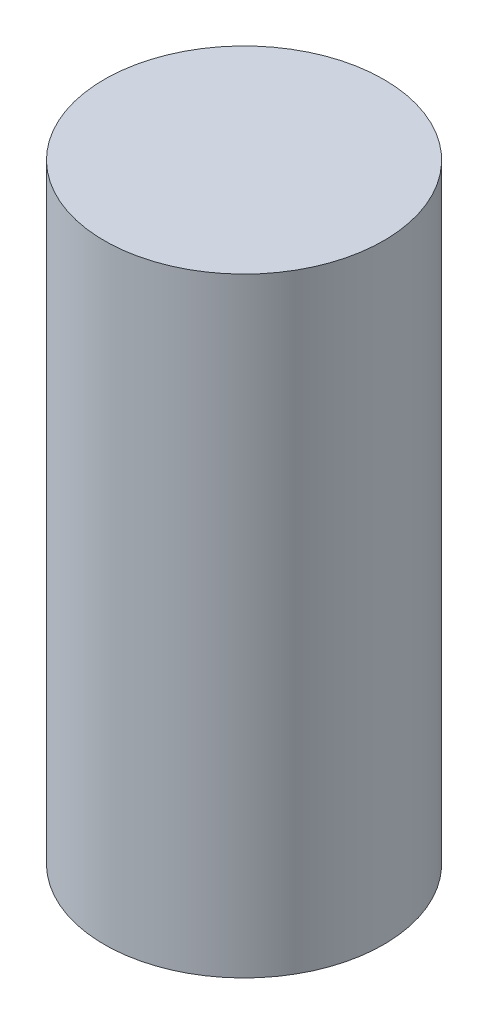
from build123d import *

# Parameters (mm, degrees)
SKETCH1_R           = 1.49
BOSS_EXTRUDE1_DEPTH = 6.5


with BuildPart() as part:
    # Sketch1 → Boss-Extrude1 (new body)
    with BuildSketch(Plane(origin=(0, 0, 0), x_dir=(1, 0, 0), z_dir=(0, 1, 0))):
        with Locations(Location((0, 0, 0), (0, 0, 90))):
            Circle(SKETCH1_R)
    extrude(amount=BOSS_EXTRUDE1_DEPTH)


solid = part.part
